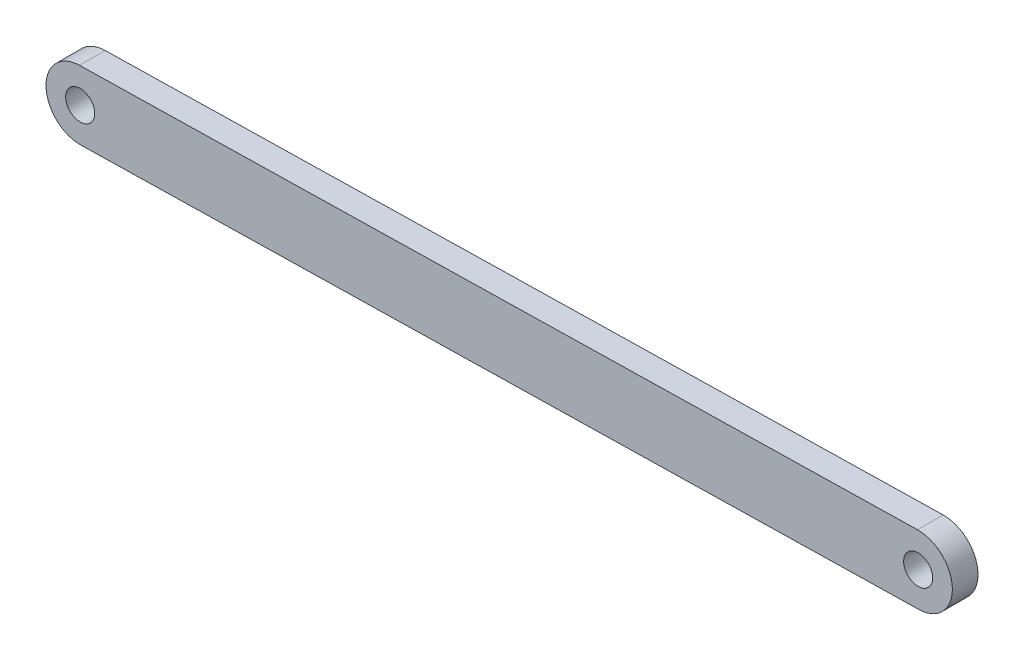
from build123d import *

# Parameters (mm, degrees)
SKETCH1_R           = 1.7
BOSS_EXTRUDE1_DEPTH = 3


with BuildPart() as part:
    # Sketch1 → Boss-Extrude1 (new body)
    with BuildSketch(Plane.XY):
        with BuildLine():
            Line((-12.16147421, 4.847845645), (85.836586078, 6.811762841))
            ThreePointArc((85.836586078, 6.811762841), (89.915928467, 2.892711212), (85.996876838, -1.186631177))
            Line((85.996876838, -1.186631177), (-12.00118345, -3.150548374))
            ThreePointArc((-12.00118345, -3.150548374), (-16.080525839, 0.768503256), (-12.16147421, 4.847845645))
        make_face()
        with Locations((-12.08132883, 0.848648636)):
            Circle(SKETCH1_R, mode=Mode.SUBTRACT)
        with Locations((85.916731458, 2.812565832)):
            Circle(SKETCH1_R, mode=Mode.SUBTRACT)
    extrude(amount=BOSS_EXTRUDE1_DEPTH)


solid = part.part
